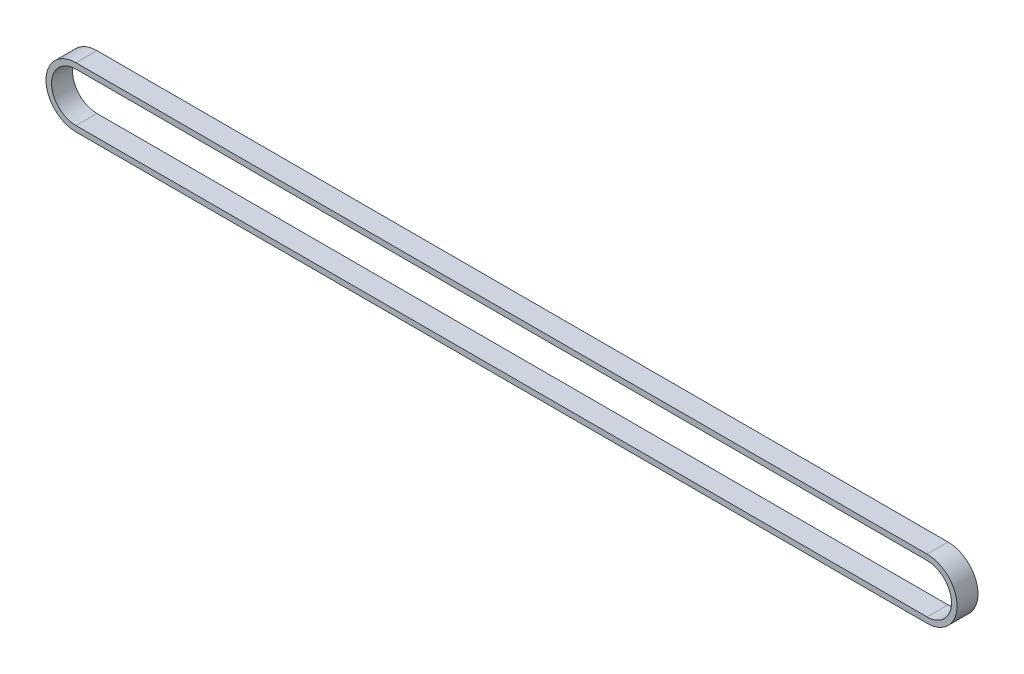
from build123d import *

# Parameters (mm, degrees)
EXTRUDE_1_DEPTH = 15


with BuildPart() as part:
    # 草图1 → 凸台-拉伸1 (new body)
    with BuildSketch(Plane.XY):
        with BuildLine():
            Line((0, 21.5), (610, 21.5))
            ThreePointArc((610, 21.5), (631.5, 0), (610, -21.5))
            Line((610, -21.5), (0, -21.5))
            ThreePointArc((0, -21.5), (-21.5, 0), (0, 21.5))
        make_face()
        with BuildLine():
            Line((0, 17.5), (610, 17.5))
            ThreePointArc((610, 17.5), (627.5, 0), (610, -17.5))
            Line((610, -17.5), (0, -17.5))
            ThreePointArc((0, -17.5), (-17.5, 0), (0, 17.5))
        make_face(mode=Mode.SUBTRACT)
    extrude(amount=EXTRUDE_1_DEPTH)


solid = part.part
